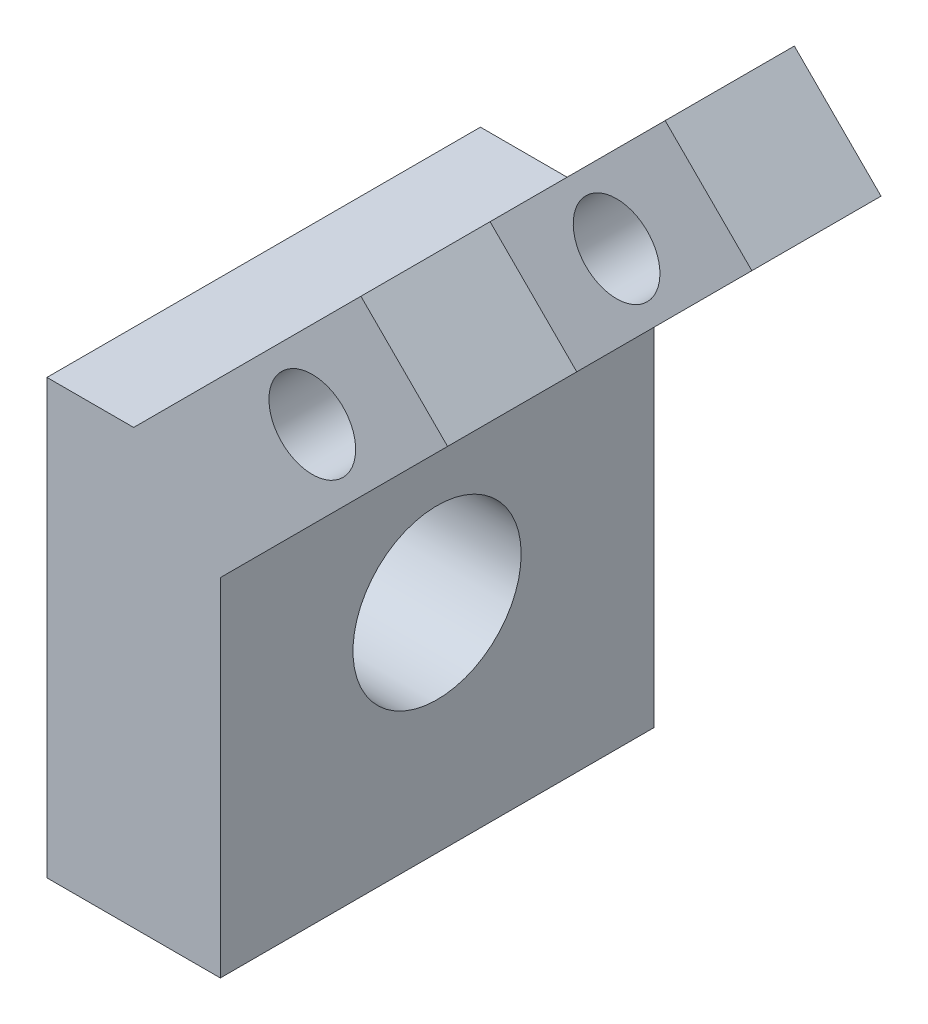
from build123d import *

# Parameters (mm, degrees)
SKETCH1_W           = 25
SKETCH1_H           = 25
SKETCH1_R           = 4.85
BOSS_EXTRUDE1_DEPTH = 10
BOSS_EXTRUDE2_DEPTH = 12.5
CUT_EXTRUDE1_DEPTH  = 5.05
SKETCH4_R           = 2.5
CUT_EXTRUDE2_DEPTH  = 43.598275722
SCALE1_SCALE        = 1.5


with BuildPart() as part:
    # Sketch1 → Boss-Extrude1 (new body)
    with BuildSketch(Plane(origin=(0, 0, 0), x_dir=(0, 0, -1), z_dir=(1, 0, 0))):
        Rectangle(SKETCH1_W, SKETCH1_H)
        Circle(SKETCH1_R, mode=Mode.SUBTRACT)
    extrude(amount=BOSS_EXTRUDE1_DEPTH)

    # Sketch2 → Boss-Extrude2 (add, symmetric)
    with BuildSketch(Plane.XY):
        Polygon((5, 12.5), (18.106601718, 25.606601718), (23.106601718, 20.606601718), (10, 7.5), (10, 12.5), align=None)
    extrude(amount=BOSS_EXTRUDE2_DEPTH, both=True)

    # Sketch3 → Cut-Extrude1 (cut, symmetric)
    with BuildSketch(Plane.XY):
        Polygon((23.106601718, 20.606601718), (18.106601718, 25.606601718), (5, 12.5), (10, 12.5), (10, 7.5), align=None)
    extrude(amount=CUT_EXTRUDE1_DEPTH, both=True, mode=Mode.SUBTRACT)

    # Sketch4 → Cut-Extrude2 (cut, through all)
    with BuildSketch(Plane(origin=(0, 0, -12.5), x_dir=(-1, 0, 0), z_dir=(0, 0, -1))):
        with Locations(Location((-15.303300859, 17.803300859, 0), (0, 0, 90))):
            Circle(SKETCH4_R)
    extrude(amount=-CUT_EXTRUDE2_DEPTH, mode=Mode.SUBTRACT)


with BuildPart() as part_1:
    # Scale1: scaled about (7.010691975, 3.593426571, 0)
    add(part.part.scale(SCALE1_SCALE).moved(Location((-3.505345988, -1.796713286, 0))))


solid = part_1.part
